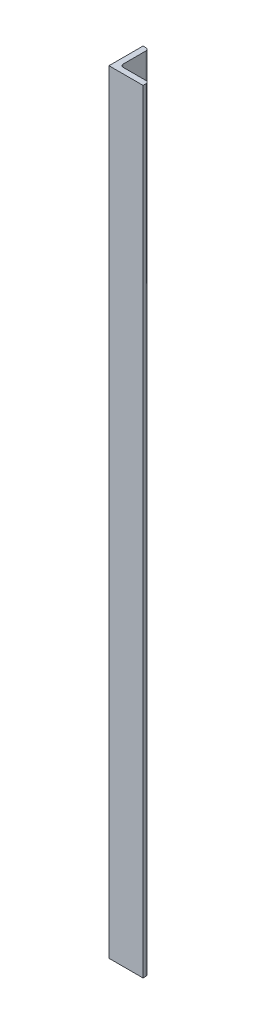
from build123d import *

# Parameters (mm, degrees)
BOSS_EXTRUDE1_DEPTH = 431.8


with BuildPart() as part:
    # Sketch2 → Boss-Extrude1 (new body)
    with BuildSketch(Plane(origin=(0, 0, 0), x_dir=(1, 0, 0), z_dir=(0, 1, 0))):
        with BuildLine():
            Line((0, 0), (19.05, 0))
            Line((19.05, 0), (19.05, 1.5875))
            ThreePointArc((19.05, 1.5875), (18.585032015, 2.710032015), (17.4625, 3.175))
            Line((17.4625, 3.175), (4.7625, 3.175))
            ThreePointArc((4.7625, 3.175), (3.639967985, 3.639967985), (3.175, 4.7625))
            Line((3.175, 4.7625), (3.175, 17.4625))
            ThreePointArc((3.175, 17.4625), (2.710032015, 18.585032015), (1.5875, 19.05))
            Line((1.5875, 19.05), (0, 19.05))
            Line((0, 19.05), (0, 0))
        make_face()
    extrude(amount=BOSS_EXTRUDE1_DEPTH)


solid = part.part
